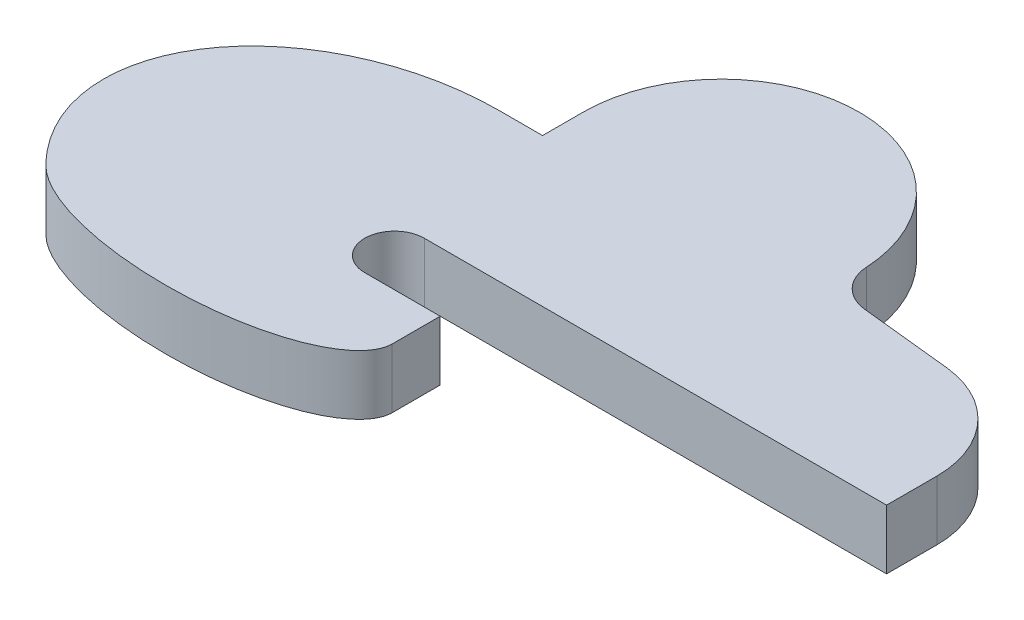
from build123d import *

# Parameters (mm, degrees)
BOSS_EXTRUDE2_DEPTH = 3


with BuildPart() as part:
    # Sketch1 → Boss-Extrude2 (new body)
    with BuildSketch(Plane(origin=(0, 0, 0), x_dir=(1, 0, 0), z_dir=(0, 1, 0))):
        with BuildLine():
            Line((0, 0), (-3.8, 0))
            ThreePointArc((-3.8, 0), (-5.3, 1.5), (-3.8, 3))
            Line((-3.8, 3), (19.47, 3))
            Line((19.47, 3), (19.47, 5.531130567))
            ThreePointArc((19.47, 5.531130567), (18.185724127, 8.876783599), (14.992642316, 10.503740044))
            Line((14.992642316, 10.503740044), (10.377958193, 10.98876289))
            ThreePointArc((10.377958193, 10.98876289), (9.137308684, 11.6), (8.589916769, 12.870111846))
            ThreePointArc((8.589916769, 12.870111846), (1.462812318, 19.44335103), (-5.3, 12.495872295))
            Line((-5.3, 12.495872295), (-5.3, 10.452302322))
            Line((-5.3, 10.452302322), (-7.465871057, 10.452302322))
            add(Edge.make_bspline(
                [(-7.465871057, 10.452302322), (-30.701590518, 10.452302322), (-16.41813294, -3.426214639)],
                knots=[4.71238898, 4.71238898, 4.71238898, 6.945216018, 6.945216018, 6.945216018], degree=2, weights=[1, 0.438907831, 1]))
            add(Edge.make_bspline(
                [(-16.41813294, -3.426214639), (-13.830923799, -5.940075569), (-6.932052933, -5.517711421), (-0.033182068, -5.095347274), (0, -2.421060194)],
                knots=[3.523742773, 3.523742773, 3.523742773, 4.90346404, 4.90346404, 6.283185307, 6.283185307, 6.283185307], degree=2, weights=[1, 0.77133472, 1, 0.77133472, 1]))
            Line((0, -2.421060194), (0, 0))
        make_face()
    extrude(amount=BOSS_EXTRUDE2_DEPTH)


solid = part.part
